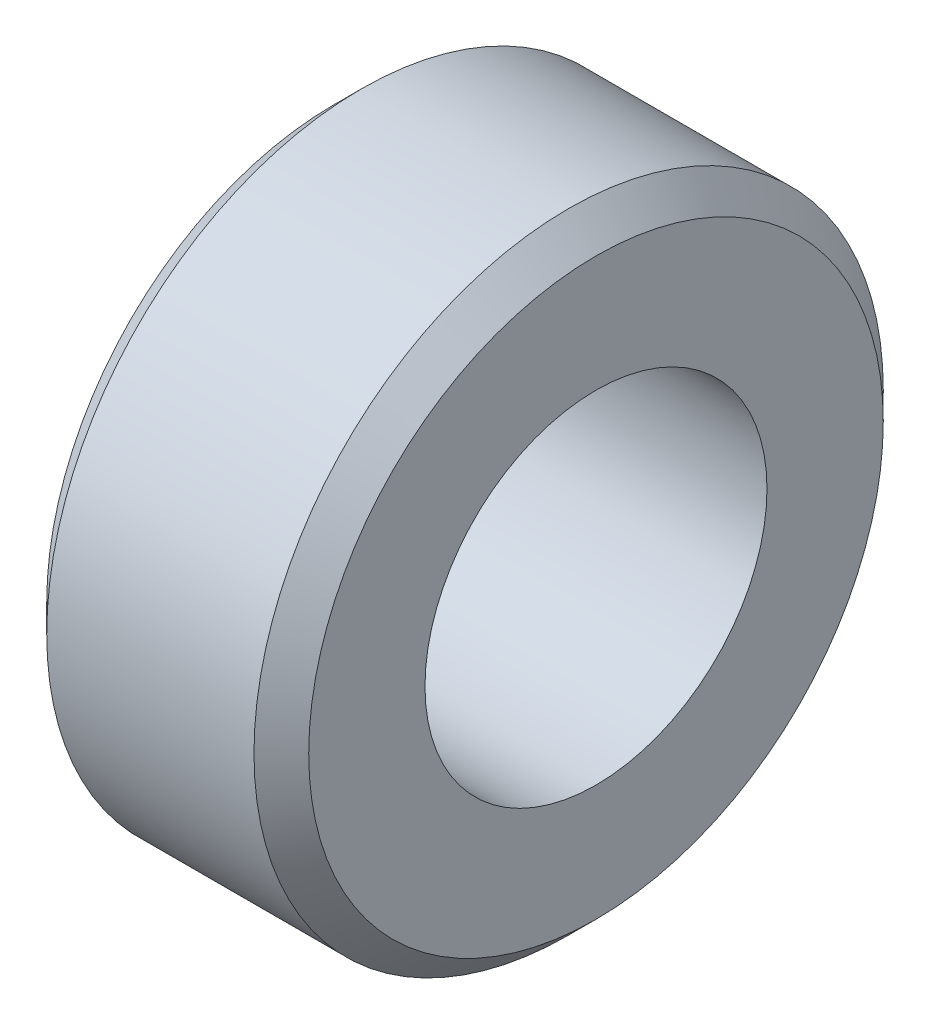
from build123d import *


with BuildPart() as part:
    # Esboço1 → Revolução1 (revolve)
    with BuildSketch(Plane.XY, mode=Mode.PRIVATE) as revolu_o1_sk:
        Polygon((-9.575, 21), (-7.575, 23), (7.575, 23), (9.575, 21), (9.575, 12.5), (-9.575, 12.5), align=None)
    revolve(revolu_o1_sk.sketch.rotate(Axis((-9.575, 0, 0), (1, 0, 0)), 90), axis=Axis((-9.575, 0, 0), (1, 0, 0)))


solid = part.part
